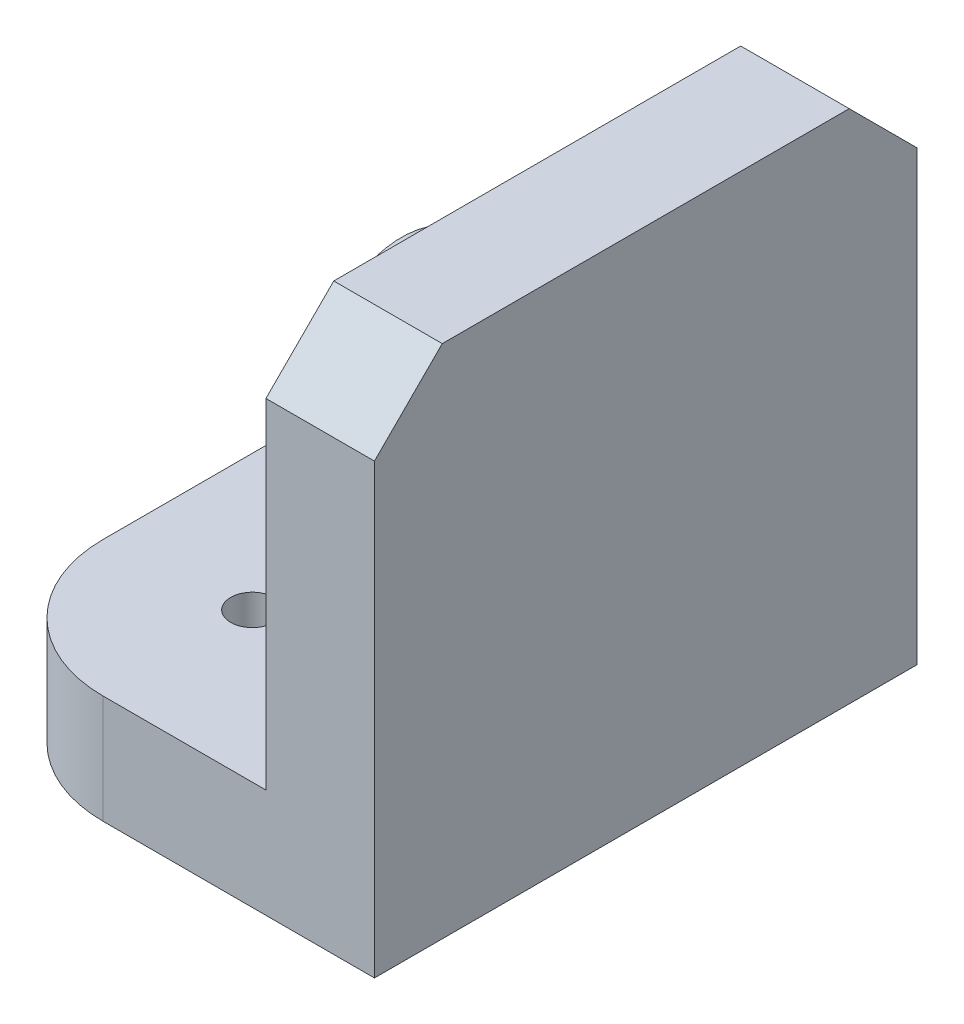
from build123d import *

# Parameters (mm, degrees)
CROQUIS1_W              = 4
CROQUIS1_H              = 30
CROQUIS1_H_2            = 8
SALIENTE_EXTRUIR1_DEPTH = 20
CROQUIS2_R              = 6.44
SALIENTE_EXTRUIR2_DEPTH = 10
CHAFL_N1_SIZE           = 5
REDONDEO1_R             = 10
CROQUIS3_R              = 1.6
CORTAR_EXTRUIR1_DEPTH   = 10


with BuildPart() as part:
    # Croquis1 → Saliente-Extruir1 (new, symmetric)
    with BuildSketch(Plane.XY):
        with Locations((-2, 19)):
            Rectangle(CROQUIS1_W, CROQUIS1_H)
        with Locations((2, 19)):
            Rectangle(CROQUIS1_W, CROQUIS1_H)
        Polygon((0, -4), (0, 4), (-4, 4), (-26, 4), (-26, -4), align=None)
        with Locations((2, 0)):
            Rectangle(CROQUIS1_W, CROQUIS1_H_2)
    extrude(amount=SALIENTE_EXTRUIR1_DEPTH, both=True)

    # Croquis2 → Saliente-Extruir2 (add)
    with BuildSketch(Plane.ZY.offset(4)):
        with Locations(Location((0, 17.85, 0), (0, 0, 270))):
            Circle(CROQUIS2_R)
    extrude(amount=SALIENTE_EXTRUIR2_DEPTH)

    # Chaflán1
    chafl_n1_edges = [part.edges().sort_by_distance(p)[0] for p in [
        (0, 34, 20),
        (0, 34, -20),
    ]]
    chamfer(chafl_n1_edges, length=CHAFL_N1_SIZE)

    # Redondeo1
    redondeo1_edges = [part.edges().sort_by_distance(p)[0] for p in [
        (-26, 0, 20),
        (-26, 0, -20),
    ]]
    fillet(redondeo1_edges, radius=REDONDEO1_R)

    # Croquis3 → Cortar-Extruir1 (cut)
    with BuildSketch(Plane.XZ.offset(4)):
        with Locations((-16, 9)):
            Circle(CROQUIS3_R)
        with Locations(Location((-16, -9, 0), (0, 0, 180))):
            Circle(CROQUIS3_R)
    extrude(amount=-CORTAR_EXTRUIR1_DEPTH, mode=Mode.SUBTRACT)


solid = part.part
